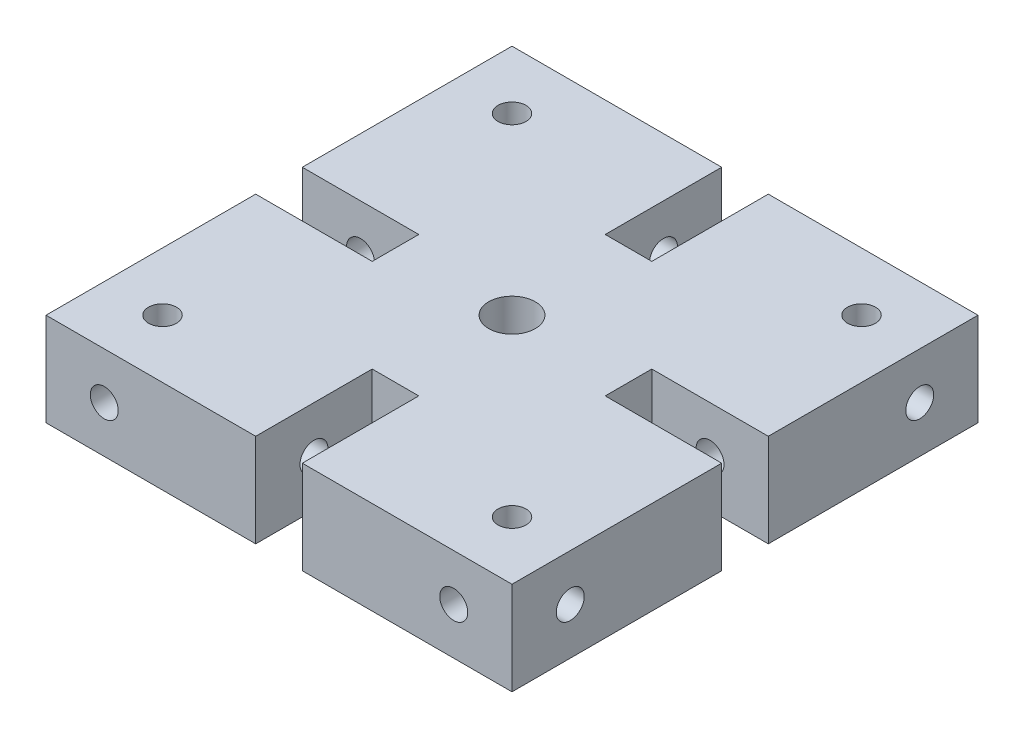
from build123d import *

# Parameters (mm, degrees)
BOSS_EXTRUDE1_DEPTH = 10
SKETCH3_R           = 1.5
CUT_EXTRUDE1_DEPTH  = 39.487010796
SKETCH4_R           = 1.5
CUT_EXTRUDE2_DEPTH  = 39.487010796
SKETCH5_R           = 2.5
CUT_EXTRUDE3_DEPTH  = 10
SKETCH9_R           = 1.5
CUT_EXTRUDE4_DEPTH  = 37.742346142


with BuildPart() as part:
    # Sketch1 → Boss-Extrude1 (new body)
    with BuildSketch(Plane(origin=(0, 0, 0), x_dir=(1, 0, 0), z_dir=(0, 1, 0))):
        Polygon((-2.5, 12.5), (-2.5, 25), (-25, 25), (-25, 2.5), (-12.5, 2.5), (-12.5, -2.5), (-25, -2.5), (-25, -25), (-2.5, -25), (-2.5, -12.5), (2.5, -12.5), (2.5, -25), (25, -25), (25, -2.5), (12.5, -2.5), (12.5, 2.5), (25, 2.5), (25, 25), (2.5, 25), (2.5, 12.5), align=None)
    extrude(amount=BOSS_EXTRUDE1_DEPTH)

    # Sketch3 → Cut-Extrude1 (cut, symmetric)
    with BuildSketch(Plane.ZY.offset(2.5)):
        with Locations((-18.75, 5)):
            Circle(SKETCH3_R)
    cut_extrude1 = extrude(amount=CUT_EXTRUDE1_DEPTH, both=True, mode=Mode.SUBTRACT)

    # Mirror1: Cut-Extrude1 across plane
    add(cut_extrude1.mirror(Plane.XY), mode=Mode.SUBTRACT)

    # Sketch4 → Cut-Extrude2 (cut, symmetric)
    with BuildSketch(Plane.XY.offset(2.5)):
        with Locations(Location((-18.75, 5, 0), (0, 0, 270))):
            Circle(SKETCH4_R)
    cut_extrude2 = extrude(amount=CUT_EXTRUDE2_DEPTH, both=True, mode=Mode.SUBTRACT)

    # Mirror2: Cut-Extrude2 across plane
    add(cut_extrude2.mirror(Plane(origin=(0, 0, 0), x_dir=(0, 0, 1), z_dir=(1, 0, 0))), mode=Mode.SUBTRACT)

    # Sketch5 → Cut-Extrude3 (cut)
    with BuildSketch(Plane(origin=(0, 10, 0), x_dir=(1, 0, 0), z_dir=(0, 1, 0))):
        with Locations(Location((0, 0, 0), (0, 0, 270))):
            Circle(SKETCH5_R)
    extrude(amount=-CUT_EXTRUDE3_DEPTH, mode=Mode.SUBTRACT)

    # Sketch9 → Cut-Extrude4 (cut, through all)
    with BuildSketch(Plane(origin=(0, 10, 0), x_dir=(1, 0, 0), z_dir=(0, 1, 0))):
        with Locations(Location((-18.75, 18.75, 0), (0, 0, 270))):
            Circle(SKETCH9_R)
        with Locations(Location((18.75, 18.75, 0), (0, 0, 270))):
            Circle(SKETCH9_R)
        with Locations(Location((18.75, -18.75, 0), (0, 0, 270))):
            Circle(SKETCH9_R)
        with Locations(Location((-18.75, -18.75, 0), (0, 0, 270))):
            Circle(SKETCH9_R)
    extrude(amount=-CUT_EXTRUDE4_DEPTH, mode=Mode.SUBTRACT)


solid = part.part
